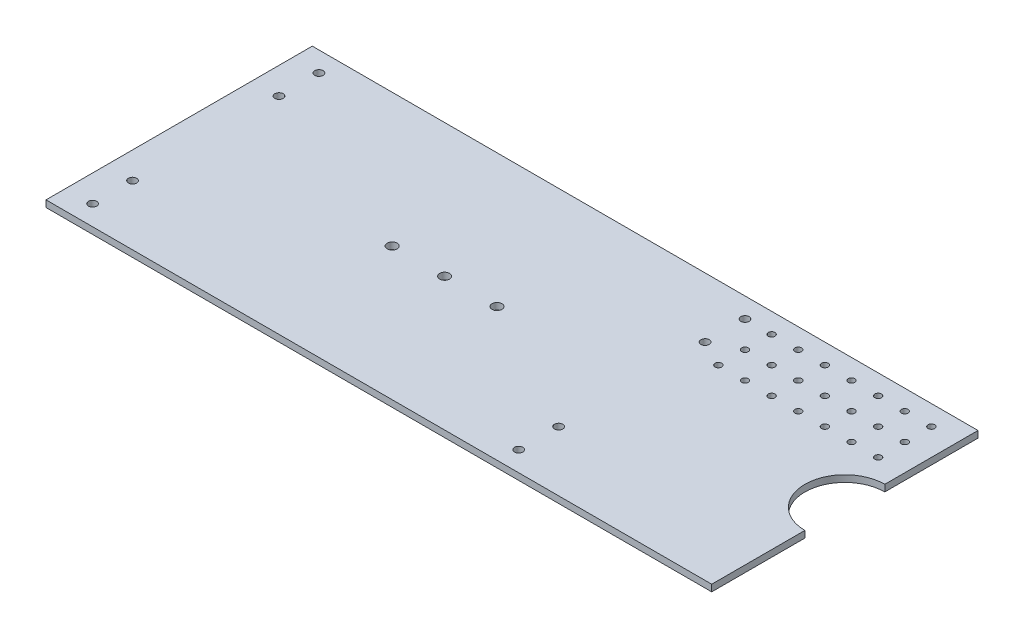
from build123d import *

# Parameters (mm, degrees)
SKETCH1_W               = 635
SKETCH1_H               = 254
BOSS_EXTRUDE1_DEPTH     = 6.35
CUT_EXTRUDE2_DEPTH      = 343.016918441
CUT_EXTRUDE2_DEPTH_BACK = 343.016918441
SKETCH2_R               = 4.7625
SKETCH3_R               = 3.96875
CUT_EXTRUDE4_DEPTH      = 343.016918441
SKETCH4_R               = 38.1
CUT_EXTRUDE6_DEPTH      = 343.016918441
SKETCH5_R               = 3.175
CUT_EXTRUDE7_DEPTH      = 343.016918441


with BuildPart() as part:
    # Sketch1 → Boss-Extrude1 (new body)
    with BuildSketch(Plane(origin=(0, 0, 0), x_dir=(1, 0, 0), z_dir=(0, 1, 0))):
        Rectangle(SKETCH1_W, SKETCH1_H)
    extrude(amount=BOSS_EXTRUDE1_DEPTH)

    # Sketch2 → Cut-Extrude2 (cut, two sides: drawn at the far end of the back side and taken through both)
    with BuildSketch(Plane(origin=(0, 0, 0), x_dir=(-1, 0, 0), z_dir=(0, 1, 0)).offset(-CUT_EXTRUDE2_DEPTH_BACK)):
        with Locations(Location((114.3, 0, 0), (0, 0, 90))):
            Circle(SKETCH2_R)
        with Locations(Location((64.3, 0, 0), (0, 0, 90))):
            Circle(SKETCH2_R)
        with Locations(Location((14.3, 0, 0), (0, 0, 90))):
            Circle(SKETCH2_R)
    extrude(amount=CUT_EXTRUDE2_DEPTH + CUT_EXTRUDE2_DEPTH_BACK, mode=Mode.SUBTRACT)

    # Sketch3 → Cut-Extrude4 (cut, through all)
    with BuildSketch(Plane(origin=(0, 0, 0), x_dir=(1, 0, 0), z_dir=(0, 1, 0))):
        with Locations(Location((-292.1, 107.95, 0), (0, 0, 270))):
            Circle(SKETCH3_R)
        with Locations(Location((-292.1, 69.85, 0), (0, 0, 270))):
            Circle(SKETCH3_R)
        with Locations(Location((-292.1, -69.85, 0), (0, 0, 270))):
            Circle(SKETCH3_R)
        with Locations(Location((-292.1, -107.95, 0), (0, 0, 270))):
            Circle(SKETCH3_R)
        with Locations(Location((114.3, 107.95, 0), (0, 0, 270))):
            Circle(SKETCH3_R)
        with Locations(Location((114.3, 69.85, 0), (0, 0, 270))):
            Circle(SKETCH3_R)
        with Locations(Location((114.3, -69.85, 0), (0, 0, 270))):
            Circle(SKETCH3_R)
        with Locations(Location((114.3, -107.95, 0), (0, 0, 270))):
            Circle(SKETCH3_R)
    extrude(amount=CUT_EXTRUDE4_DEPTH, mode=Mode.SUBTRACT)

    # Sketch4 → Cut-Extrude6 (cut, through all)
    with BuildSketch(Plane(origin=(0, 0, 0), x_dir=(1, 0, 0), z_dir=(0, 1, 0))):
        with Locations((317.5, 0)):
            Circle(SKETCH4_R)
    extrude(amount=CUT_EXTRUDE6_DEPTH, mode=Mode.SUBTRACT)

    # Sketch5 → Cut-Extrude7 (cut, through all)
    with BuildSketch(Plane(origin=(0, 6.35, 0), x_dir=(1, 0, 0), z_dir=(0, 1, 0))):
        with Locations(Location((139.7, 107.95, 0), (0, 0, 270))):
            Circle(SKETCH5_R)
        with Locations(Location((165.1, 107.95, 0), (0, 0, 270))):
            Circle(SKETCH5_R)
        with Locations(Location((190.5, 107.95, 0), (0, 0, 270))):
            Circle(SKETCH5_R)
        with Locations(Location((215.9, 107.95, 0), (0, 0, 270))):
            Circle(SKETCH5_R)
        with Locations(Location((241.3, 107.95, 0), (0, 0, 270))):
            Circle(SKETCH5_R)
        with Locations(Location((266.7, 107.95, 0), (0, 0, 270))):
            Circle(SKETCH5_R)
        with Locations(Location((292.1, 107.95, 0), (0, 0, 270))):
            Circle(SKETCH5_R)
        with Locations(Location((165.1, 82.55, 0), (0, 0, 270))):
            Circle(SKETCH5_R)
        with Locations(Location((190.5, 82.55, 0), (0, 0, 270))):
            Circle(SKETCH5_R)
        with Locations(Location((215.9, 82.55, 0), (0, 0, 270))):
            Circle(SKETCH5_R)
        with Locations(Location((241.3, 82.55, 0), (0, 0, 270))):
            Circle(SKETCH5_R)
        with Locations(Location((266.7, 82.55, 0), (0, 0, 270))):
            Circle(SKETCH5_R)
        with Locations(Location((292.1, 82.55, 0), (0, 0, 270))):
            Circle(SKETCH5_R)
        with Locations(Location((165.1, 57.15, 0), (0, 0, 270))):
            Circle(SKETCH5_R)
        with Locations(Location((190.5, 57.15, 0), (0, 0, 270))):
            Circle(SKETCH5_R)
        with Locations(Location((215.9, 57.15, 0), (0, 0, 270))):
            Circle(SKETCH5_R)
        with Locations(Location((241.3, 57.15, 0), (0, 0, 270))):
            Circle(SKETCH5_R)
        with Locations(Location((266.7, 57.15, 0), (0, 0, 270))):
            Circle(SKETCH5_R)
        with Locations(Location((292.1, 57.15, 0), (0, 0, 270))):
            Circle(SKETCH5_R)
        with Locations(Location((139.7, 82.55, 0), (0, 0, 270))):
            Circle(SKETCH5_R)
        with Locations(Location((139.7, 57.15, 0), (0, 0, 270))):
            Circle(SKETCH5_R)
    extrude(amount=-CUT_EXTRUDE7_DEPTH, mode=Mode.SUBTRACT)


solid = part.part
